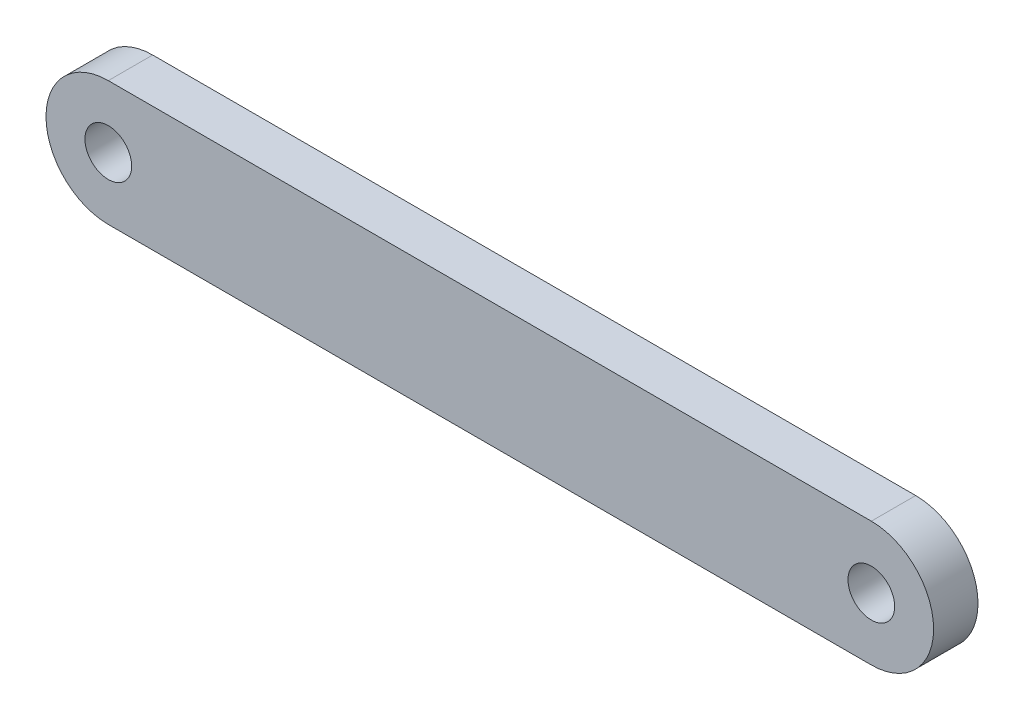
from build123d import *

# Parameters (mm, degrees)
SKETCH1_W           = 57
SKETCH1_H           = 8
BOSS_EXTRUDE1_DEPTH = 2.85
CUT_EXTRUDE1_DEPTH  = 29.920105463
SKETCH3_R           = 1.5
CUT_EXTRUDE2_DEPTH  = 29.920105463


with BuildPart() as part:
    # Sketch1 → Boss-Extrude1 (new body)
    with BuildSketch(Plane.XY):
        Rectangle(SKETCH1_W, SKETCH1_H)
    extrude(amount=BOSS_EXTRUDE1_DEPTH)

    # Sketch2 → Cut-Extrude1 (cut, through all)
    with BuildSketch(Plane.XY.offset(2.85)):
        with BuildLine():
            Line((24.5, -4), (29.5, -4))
            Line((29.5, -4), (29.5, 4))
            Line((29.5, 4), (24.5, 4))
            ThreePointArc((24.5, 4), (28.5, 0), (24.5, -4))
        make_face()
    cut_extrude1 = extrude(amount=-CUT_EXTRUDE1_DEPTH, mode=Mode.SUBTRACT)

    # Sketch3 → Cut-Extrude2 (cut, through all)
    with BuildSketch(Plane.XY.offset(2.85)):
        with Locations((24.5, 0)):
            Circle(SKETCH3_R)
    cut_extrude2 = extrude(amount=-CUT_EXTRUDE2_DEPTH, mode=Mode.SUBTRACT)

    # Mirror1: Cut-Extrude1, Cut-Extrude2 across plane
    add(cut_extrude1.mirror(Plane(origin=(0, 0, 0), x_dir=(0, 0, 1), z_dir=(1, 0, 0))), mode=Mode.SUBTRACT)
    add(cut_extrude2.mirror(Plane(origin=(0, 0, 0), x_dir=(0, 0, 1), z_dir=(1, 0, 0))), mode=Mode.SUBTRACT)


solid = part.part
